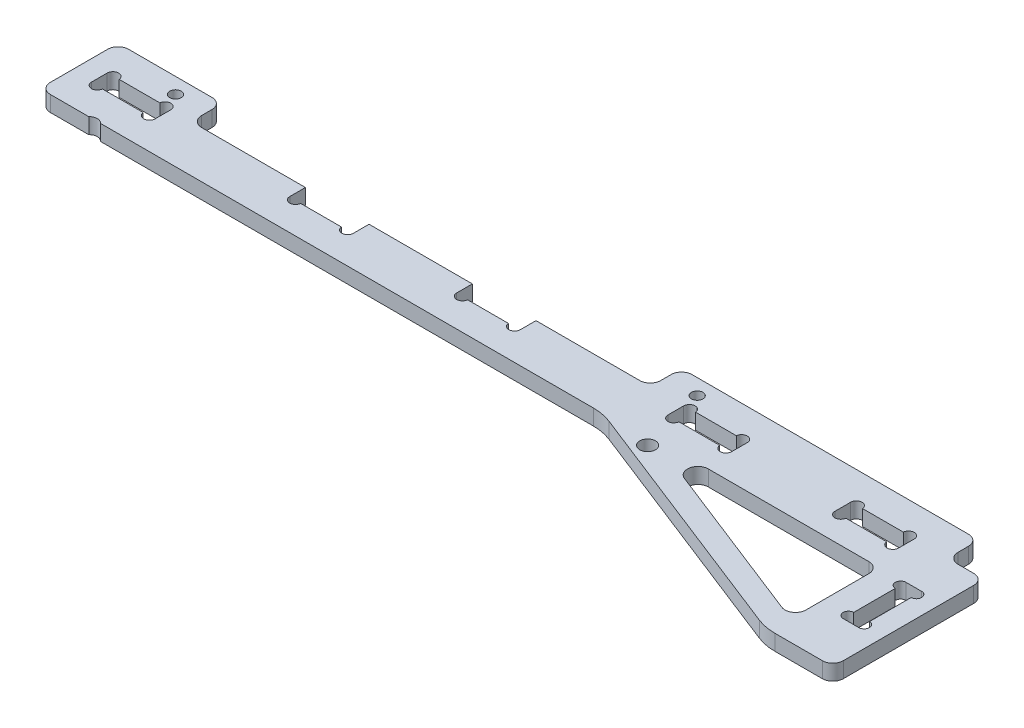
from build123d import *

# Parameters (mm, degrees)
SKETCH_1_W             = 165
SKETCH_1_H             = 9
EXTRUDE_1_DEPTH        = 3
SKETCH_2_W             = 20
SKETCH_2_H             = 6
SKETCH_2_W_2           = 57
EXTRUDE_2_DEPTH        = 3
FILLET_1_R             = 2
SKETCH_3_W             = 12
SKETCH_3_H             = 3
CUT_EXTRUDE_1_DEPTH    = 87.113297463
SKETCH_5_R             = 1
CUT_EXTRUDE_3_DEPTH    = 87.113297463
EXTRUDE_4_DEPTH        = 3
SKETCH_10_R            = 1
CUT_EXTRUDE_5_DEPTH    = 93.841262378
CUT_EXTRUDE_6415_DEPTH = 93.841262378
FILLET_2_R             = 2
FILLET_3_R             = 10
CUT_EXTRUDE_6_DEPTH    = 93.841262378
FILLET_4_R             = 2
SKETCH_12_R            = 1.1
SKETCH_12_R_2          = 1.5
CUT_EXTRUDE_7_DEPTH    = 93.841262378


with BuildPart() as part:
    # 草图1 → 凸台-拉伸1 (new body)
    with BuildSketch(Plane(origin=(0, 0, 0), x_dir=(1, 0, 0), z_dir=(0, 1, 0))):
        Rectangle(SKETCH_1_W, SKETCH_1_H)
    extrude(amount=EXTRUDE_1_DEPTH)

    # 草图2 → 凸台-拉伸2 (add)
    with BuildSketch(Plane(origin=(0, 3, 0), x_dir=(1, 0, 0), z_dir=(0, 1, 0))):
        with Locations((-72.5, 7.5)):
            Rectangle(SKETCH_2_W, SKETCH_2_H)
        Polygon((82.5, -24.5), (82.5, -4.5), (25.5, -4.5), (76.5, -24.5), align=None)
        with Locations((54, 7.5)):
            Rectangle(SKETCH_2_W_2, SKETCH_2_H)
    extrude(amount=-EXTRUDE_2_DEPTH)

    # 圆角1
    fillet_1_edges = [part.edges().sort_by_distance(p)[0] for p in [
        (-82.5, 1.5, -10.5),
        (-62.5, 1.5, -10.5),
        (-62.5, 1.5, -4.5),
        (82.5, 1.5, -10.5),
        (25.5, 1.5, -4.5),
        (25.5, 1.5, -10.5),
        (-82.5, 1.5, 4.5),
    ]]
    fillet(fillet_1_edges, radius=FILLET_1_R)

    # 草图3 → 切除-拉伸1 (cut, through all)
    with BuildSketch(Plane(origin=(0, 3, 0), x_dir=(1, 0, 0), z_dir=(0, 1, 0))):
        with Locations((-72.5, 3)):
            Rectangle(SKETCH_3_W, SKETCH_3_H)
        with Locations((-34.5, 3)):
            Rectangle(SKETCH_3_W, SKETCH_3_H)
        with Locations((-2.5, 3)):
            Rectangle(SKETCH_3_W, SKETCH_3_H)
        with Locations((38, 3)):
            Rectangle(SKETCH_3_W, SKETCH_3_H)
        with Locations((70, 3)):
            Rectangle(SKETCH_3_W, SKETCH_3_H)
    extrude(amount=-CUT_EXTRUDE_1_DEPTH, mode=Mode.SUBTRACT)

    # 草图5 → 切除-拉伸3 (cut, through all)
    with BuildSketch(Plane(origin=(0, 3, 0), x_dir=(1, 0, 0), z_dir=(0, 1, 0))):
        with Locations((-67.5, 4.5)):
            Circle(SKETCH_5_R)
        with Locations((-67.5, 1.5)):
            Circle(SKETCH_5_R)
        with Locations((-77.5, 1.5)):
            Circle(SKETCH_5_R)
        with Locations((-77.5, 4.5)):
            Circle(SKETCH_5_R)
        with Locations((-29.5, 1.5)):
            Circle(SKETCH_5_R)
        with Locations((-39.5, 1.5)):
            Circle(SKETCH_5_R)
        with Locations((2.5, 1.5)):
            Circle(SKETCH_5_R)
        with Locations((-7.5, 1.5)):
            Circle(SKETCH_5_R)
        with Locations((33, 1.5)):
            Circle(SKETCH_5_R)
        with Locations((43, 1.5)):
            Circle(SKETCH_5_R)
        with Locations((43, 4.5)):
            Circle(SKETCH_5_R)
        with Locations((33, 4.5)):
            Circle(SKETCH_5_R)
        with Locations((75, 4.5)):
            Circle(SKETCH_5_R)
        with Locations((65, 4.5)):
            Circle(SKETCH_5_R)
        with Locations((65, 1.5)):
            Circle(SKETCH_5_R)
        with Locations((75, 1.5)):
            Circle(SKETCH_5_R)
    extrude(amount=-CUT_EXTRUDE_3_DEPTH, mode=Mode.SUBTRACT)

    # 草图9 → 凸台-拉伸4 (add)
    with BuildSketch(Plane(origin=(0, 3, 0), x_dir=(1, 0, 0), z_dir=(0, 1, 0))):
        Polygon((82.5, -15.5), (82.5, -24.5), (89.5, -24.5), (89.5, 4.5), (82.5, 4.5), (82.5, -3.5), (85.5, -3.5), (85.5, -15.5), align=None)
    extrude(amount=-EXTRUDE_4_DEPTH)

    # 草图10 → 切除-拉伸5 (cut, through all)
    with BuildSketch(Plane(origin=(0, 3, 0), x_dir=(1, 0, 0), z_dir=(0, 1, 0))):
        with Locations((85.5, -4.5)):
            Circle(SKETCH_10_R)
        with Locations((85.5, -14.5)):
            Circle(SKETCH_10_R)
        with Locations((82.5, -14.5)):
            Circle(SKETCH_10_R)
        with Locations((82.5, -4.5)):
            Circle(SKETCH_10_R)
    extrude(amount=-CUT_EXTRUDE_5_DEPTH, mode=Mode.SUBTRACT)

    # 草图6 → Cut-Extrude 6415 (cut, through all)
    with BuildSketch(Plane(origin=(0, 3, 0), x_dir=(1, 0, 0), z_dir=(0, 1, 0))):
        with BuildLine():
            Line((-78.6, 4.5), (-78.6, 1.5))
            ThreePointArc((-78.6, 1.5), (-77.550051841, 0.401139311), (-76.404554885, 1.4))
            Line((-76.404554885, 1.4), (-68.595445115, 1.4))
            ThreePointArc((-68.595445115, 1.4), (-67.449948159, 0.401139311), (-66.4, 1.5))
            Line((-66.4, 1.5), (-66.4, 4.5))
            ThreePointArc((-66.4, 4.5), (-67.449948159, 5.598860689), (-68.595445115, 4.6))
            Line((-68.595445115, 4.6), (-76.404554885, 4.6))
            ThreePointArc((-76.404554885, 4.6), (-77.550051841, 5.598860689), (-78.6, 4.5))
        make_face()
        with BuildLine():
            Line((34.095445115, 4.6), (41.904554885, 4.6))
            ThreePointArc((41.904554885, 4.6), (43.050051841, 5.598860689), (44.1, 4.5))
            Line((44.1, 4.5), (44.1, 1.5))
            ThreePointArc((44.1, 1.5), (43.050051841, 0.401139311), (41.904554885, 1.4))
            Line((41.904554885, 1.4), (34.095445115, 1.4))
            ThreePointArc((34.095445115, 1.4), (32.949948159, 0.401139311), (31.9, 1.5))
            Line((31.9, 1.5), (31.9, 4.5))
            ThreePointArc((31.9, 4.5), (32.949948159, 5.598860689), (34.095445115, 4.6))
        make_face()
        with BuildLine():
            Line((63.9, 4.5), (63.9, 1.5))
            ThreePointArc((63.9, 1.5), (64.949948159, 0.401139311), (66.095445115, 1.4))
            Line((66.095445115, 1.4), (73.904554885, 1.4))
            ThreePointArc((73.904554885, 1.4), (75.050051841, 0.401139311), (76.1, 1.5))
            Line((76.1, 1.5), (76.1, 4.5))
            ThreePointArc((76.1, 4.5), (75.050051841, 5.598860689), (73.904554885, 4.6))
            Line((73.904554885, 4.6), (66.095445115, 4.6))
            ThreePointArc((66.095445115, 4.6), (64.949948159, 5.598860689), (63.9, 4.5))
        make_face()
        with BuildLine():
            Line((-38.404554885, 4.6), (-30.595445115, 4.6))
            ThreePointArc((-30.595445115, 4.6), (-29.449948159, 5.598860689), (-28.4, 4.5))
            Line((-28.4, 4.5), (-28.4, 1.5))
            ThreePointArc((-28.4, 1.5), (-29.449948159, 0.401139311), (-30.595445115, 1.4))
            Line((-30.595445115, 1.4), (-38.404554885, 1.4))
            ThreePointArc((-38.404554885, 1.4), (-39.550051841, 0.401139311), (-40.6, 1.5))
            Line((-40.6, 1.5), (-40.6, 4.5))
            ThreePointArc((-40.6, 4.5), (-39.550051841, 5.598860689), (-38.404554885, 4.6))
        make_face()
        with BuildLine():
            Line((-8.6, 4.5), (-8.6, 1.5))
            ThreePointArc((-8.6, 1.5), (-7.550051841, 0.401139311), (-6.404554885, 1.4))
            Line((-6.404554885, 1.4), (1.404554885, 1.4))
            ThreePointArc((1.404554885, 1.4), (2.550051841, 0.401139311), (3.6, 1.5))
            Line((3.6, 1.5), (3.6, 4.5))
            ThreePointArc((3.6, 4.5), (2.550051841, 5.598860689), (1.404554885, 4.6))
            Line((1.404554885, 4.6), (-6.404554885, 4.6))
            ThreePointArc((-6.404554885, 4.6), (-7.550051841, 5.598860689), (-8.6, 4.5))
        make_face()
        with BuildLine():
            Line((82.48, -5.519803903), (82.48, -13.480196097))
            ThreePointArc((82.48, -13.480196097), (81.480049025, -14.510000481), (82.5, -15.52))
            Line((82.5, -15.52), (85.5, -15.52))
            ThreePointArc((85.5, -15.52), (86.519950975, -14.510000481), (85.52, -13.480196097))
            Line((85.52, -13.480196097), (85.52, -5.519803903))
            ThreePointArc((85.52, -5.519803903), (86.519950975, -4.489999519), (85.5, -3.48))
            Line((85.5, -3.48), (82.5, -3.48))
            ThreePointArc((82.5, -3.48), (81.480049025, -4.489999519), (82.48, -5.519803903))
        make_face()
    extrude(amount=-CUT_EXTRUDE_6415_DEPTH, mode=Mode.SUBTRACT)

    # 圆角2
    fillet_2_edges = [part.edges().sort_by_distance(p)[0] for p in [
        (89.5, 1.5, 24.5),
        (89.5, 1.5, -4.5),
        (82.5, 1.5, -4.5),
    ]]
    fillet(fillet_2_edges, radius=FILLET_2_R)

    # 圆角3
    fillet_3_edges = [part.edges().sort_by_distance(p)[0] for p in [
        (76.5, 1.5, 24.5),
        (25.5, 1.5, 4.5),
    ]]
    fillet(fillet_3_edges, radius=FILLET_3_R)

    # 草图11 → 切除-拉伸6 (cut, through all)
    with BuildSketch(Plane(origin=(0, 3, 0), x_dir=(1, 0, 0), z_dir=(0, 1, 0))):
        Polygon((34.16127674, -3.6), (77.5, -3.6), (77.5, -20.595577749), align=None)
    extrude(amount=-CUT_EXTRUDE_6_DEPTH, mode=Mode.SUBTRACT)

    # 圆角4
    fillet_4_edges = [part.edges().sort_by_distance(p)[0] for p in [
        (77.5, 1.5, 20.595577749),
        (34.16127674, 1.5, 3.6),
        (77.5, 1.5, 3.6),
    ]]
    fillet(fillet_4_edges, radius=FILLET_4_R)

    # 草图12 → 切除-拉伸7 (cut, through all)
    with BuildSketch(Plane(origin=(0, 3, 0), x_dir=(1, 0, 0), z_dir=(0, 1, 0))):
        with Locations(Location((-68.5, 7.5, 0), (0, 0, 270))):
            Circle(SKETCH_12_R)
        with Locations(Location((31.5, 7.5, 0), (0, 0, 270))):
            Circle(SKETCH_12_R)
        with Locations(Location((35, -5.5, 0), (0, 0, 270))):
            Circle(SKETCH_12_R_2)
        with Locations((-72, -5.5)):
            Circle(SKETCH_12_R_2)
    extrude(amount=-CUT_EXTRUDE_7_DEPTH, mode=Mode.SUBTRACT)


solid = part.part
